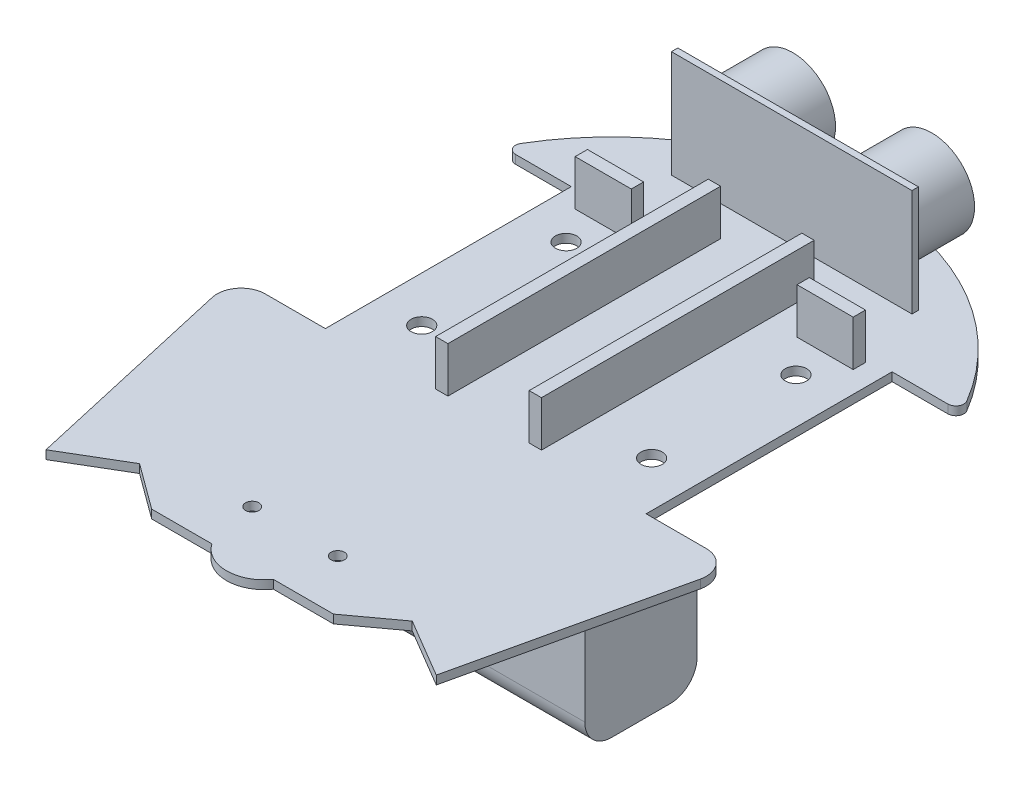
from build123d import *

# Parameters (mm, degrees)
BOSS_EXTRUDE1_DEPTH = 1.6
SKETCH6_W           = 45
SKETCH6_H           = 1.2
BOSS_EXTRUDE2_DEPTH = 20
SKETCH7_R           = 8
BOSS_EXTRUDE3_DEPTH = 12
SKETCH10_W          = 80
SKETCH10_H          = 21
BOSS_EXTRUDE4_DEPTH = 21.4
FILLET1_R           = 5
CUT_EXTRUDE1_REACH  = 132.929
SKETCH11_R          = 1.25
SKETCH11_R_2        = 2
SKETCH11_R_3        = 1.5
SKETCH12_W          = 2.3
SKETCH12_H          = 51
SKETCH12_W_2        = 10.5
SKETCH12_H_2        = 2.3
BOSS_EXTRUDE5_DEPTH = 8.5
SKETCH13_W          = 5.4
SKETCH13_H          = 10.2
BOSS_EXTRUDE7_DEPTH = 5


with BuildPart() as part:
    # Sketch5 → Boss-Extrude1 (new body)
    with BuildSketch(Plane(origin=(0, 0, 0), x_dir=(1, 0, 0), z_dir=(0, 1, 0))):
        with BuildLine():
            Line((-25.5, 9.227208522), (-17, 3))
            Line((-17, 3), (-5.744562647, 3))
            ThreePointArc((-5.744562647, 3), (0, 0), (5.744562647, 3))
            Line((5.744562647, 3), (17, 3))
            Line((17, 3), (25.5, 9.227208522))
            Line((25.5, 9.227208522), (36.5, 2.727208522))
            Line((36.5, 2.727208522), (45.638339075, 42.980975538))
            ThreePointArc((45.638339075, 42.980975538), (44.766606918, 46.784961322), (41.25, 48.477208522))
            Line((41.25, 48.477208522), (30, 48.477208522))
            Line((30, 48.477208522), (30, 94.477208522))
            Line((30, 94.477208522), (40.42392202, 94.477208522))
            ThreePointArc((40.42392202, 94.477208522), (41.72734925, 95.234862609), (41.714047191, 96.742438582))
            ThreePointArc((41.714047191, 96.742438582), (0, 120.5), (-41.714047191, 96.742438582))
            ThreePointArc((-41.714047191, 96.742438582), (-41.72734925, 95.234862609), (-40.42392202, 94.477208522))
            Line((-40.42392202, 94.477208522), (-30, 94.477208522))
            Line((-30, 94.477208522), (-30, 48.477208522))
            Line((-30, 48.477208522), (-41.25, 48.477208522))
            ThreePointArc((-41.25, 48.477208522), (-44.766606918, 46.784961322), (-45.638339075, 42.980975538))
            Line((-45.638339075, 42.980975538), (-36.5, 2.727208522))
            Line((-36.5, 2.727208522), (-25.5, 9.227208522))
        make_face()
    extrude(amount=-BOSS_EXTRUDE1_DEPTH)

    # Sketch6 → Boss-Extrude2 (add)
    with BuildSketch(Plane(origin=(0, 0, 0), x_dir=(1, 0, 0), z_dir=(0, 1, 0))):
        with Locations((0, 106.3)):
            Rectangle(SKETCH6_W, SKETCH6_H)
    extrude(amount=BOSS_EXTRUDE2_DEPTH)

    # Sketch7 → Boss-Extrude3 (add)
    with BuildSketch(Plane(origin=(0, 0, -106.9), x_dir=(-1, 0, 0), z_dir=(0, 0, -1))):
        with Locations(Location((-13, 10, 0), (0, 0, 180))):
            Circle(SKETCH7_R)
        with Locations(Location((13, 10, 0), (0, 0, 180))):
            Circle(SKETCH7_R)
    extrude(amount=BOSS_EXTRUDE3_DEPTH)

    # Sketch10 → Boss-Extrude4 (add)
    with BuildSketch(Plane.XZ.offset(1.6)):
        with Locations((0, -37.5)):
            Rectangle(SKETCH10_W, SKETCH10_H)
    extrude(amount=BOSS_EXTRUDE4_DEPTH)

    # Fillet1
    fillet1_edges = [part.edges().sort_by_distance(p)[0] for p in [
        (0, -23, -48),
        (0, -23, -27),
    ]]
    fillet(fillet1_edges, radius=FILLET1_R)

    # Sketch11 → Cut-Extrude1 (cut, up to next)
    with BuildSketch(Plane(origin=(0, 0, 0), x_dir=(1, 0, 0), z_dir=(0, 1, 0)), mode=Mode.PRIVATE) as cut_extrude1_sk1:
        with Locations(Location((-8, 12.8, 0), (0, 0, 270))):
            Circle(SKETCH11_R)
    cut_extrude1_tool1 = extrude(cut_extrude1_sk1.sketch, amount=-CUT_EXTRUDE1_REACH, mode=Mode.PRIVATE) & part.part
    # Sketch11 → Cut-Extrude1 (cut, up to next)
    with BuildSketch(Plane(origin=(0, 0, 0), x_dir=(1, 0, 0), z_dir=(0, 1, 0)), mode=Mode.PRIVATE) as cut_extrude1_sk2:
        with Locations(Location((-21.5, 58, 0), (0, 0, 270))):
            Circle(SKETCH11_R_2)
    cut_extrude1_tool2 = extrude(cut_extrude1_sk2.sketch, amount=-CUT_EXTRUDE1_REACH, mode=Mode.PRIVATE) & part.part
    # Sketch11 → Cut-Extrude1 (cut, up to next)
    with BuildSketch(Plane(origin=(0, 0, 0), x_dir=(1, 0, 0), z_dir=(0, 1, 0)), mode=Mode.PRIVATE) as cut_extrude1_sk3:
        with Locations(Location((-21.5, 85, 0), (0, 0, 270))):
            Circle(SKETCH11_R_2)
    cut_extrude1_tool3 = extrude(cut_extrude1_sk3.sketch, amount=-CUT_EXTRUDE1_REACH, mode=Mode.PRIVATE) & part.part
    # Sketch11 → Cut-Extrude1 (cut, up to next)
    with BuildSketch(Plane(origin=(0, 0, 0), x_dir=(1, 0, 0), z_dir=(0, 1, 0)), mode=Mode.PRIVATE) as cut_extrude1_sk4:
        with Locations(Location((-15, 99, 0), (0, 0, 270))):
            Circle(SKETCH11_R_3)
    cut_extrude1_tool4 = extrude(cut_extrude1_sk4.sketch, amount=-CUT_EXTRUDE1_REACH, mode=Mode.PRIVATE) & part.part
    # Sketch11 → Cut-Extrude1 (cut, up to next)
    with BuildSketch(Plane(origin=(0, 0, 0), x_dir=(1, 0, 0), z_dir=(0, 1, 0)), mode=Mode.PRIVATE) as cut_extrude1_sk5:
        with Locations(Location((15, 99, 0), (0, 0, 90))):
            Circle(SKETCH11_R_3)
    cut_extrude1_tool5 = extrude(cut_extrude1_sk5.sketch, amount=-CUT_EXTRUDE1_REACH, mode=Mode.PRIVATE) & part.part
    # Sketch11 → Cut-Extrude1 (cut, up to next)
    with BuildSketch(Plane(origin=(0, 0, 0), x_dir=(1, 0, 0), z_dir=(0, 1, 0)), mode=Mode.PRIVATE) as cut_extrude1_sk6:
        with Locations(Location((21.5, 85, 0), (0, 0, 90))):
            Circle(SKETCH11_R_2)
    cut_extrude1_tool6 = extrude(cut_extrude1_sk6.sketch, amount=-CUT_EXTRUDE1_REACH, mode=Mode.PRIVATE) & part.part
    # Sketch11 → Cut-Extrude1 (cut, up to next)
    with BuildSketch(Plane(origin=(0, 0, 0), x_dir=(1, 0, 0), z_dir=(0, 1, 0)), mode=Mode.PRIVATE) as cut_extrude1_sk7:
        with Locations(Location((21.5, 58, 0), (0, 0, 90))):
            Circle(SKETCH11_R_2)
    cut_extrude1_tool7 = extrude(cut_extrude1_sk7.sketch, amount=-CUT_EXTRUDE1_REACH, mode=Mode.PRIVATE) & part.part
    # Sketch11 → Cut-Extrude1 (cut, up to next)
    with BuildSketch(Plane(origin=(0, 0, 0), x_dir=(1, 0, 0), z_dir=(0, 1, 0)), mode=Mode.PRIVATE) as cut_extrude1_sk8:
        with Locations(Location((8, 12.8, 0), (0, 0, 90))):
            Circle(SKETCH11_R)
    cut_extrude1_tool8 = extrude(cut_extrude1_sk8.sketch, amount=-CUT_EXTRUDE1_REACH, mode=Mode.PRIVATE) & part.part
    add(cut_extrude1_tool1.solids().sort_by_distance((-8, 0, -12.8))[0], mode=Mode.SUBTRACT)
    add(cut_extrude1_tool2.solids().sort_by_distance((-21.5, 0, -58))[0], mode=Mode.SUBTRACT)
    add(cut_extrude1_tool3.solids().sort_by_distance((-21.5, 0, -85))[0], mode=Mode.SUBTRACT)
    add(cut_extrude1_tool4.solids().sort_by_distance((-15, 0, -99))[0], mode=Mode.SUBTRACT)
    add(cut_extrude1_tool5.solids().sort_by_distance((15, 0, -99))[0], mode=Mode.SUBTRACT)
    add(cut_extrude1_tool6.solids().sort_by_distance((21.5, 0, -85))[0], mode=Mode.SUBTRACT)
    add(cut_extrude1_tool7.solids().sort_by_distance((21.5, 0, -58))[0], mode=Mode.SUBTRACT)
    add(cut_extrude1_tool8.solids().sort_by_distance((8, 0, -12.8))[0], mode=Mode.SUBTRACT)

    # Sketch12 → Boss-Extrude5 (add)
    with BuildSketch(Plane(origin=(0, 0, 0), x_dir=(1, 0, 0), z_dir=(0, 1, 0))):
        with Locations((-8.75, 74.5)):
            Rectangle(SKETCH12_W, SKETCH12_H)
        with Locations((-20.75, 92.35)):
            Rectangle(SKETCH12_W_2, SKETCH12_H_2)
        with Locations((20.75, 92.35)):
            Rectangle(SKETCH12_W_2, SKETCH12_H_2)
        with Locations((8.75, 74.5)):
            Rectangle(SKETCH12_W, SKETCH12_H)
    extrude(amount=BOSS_EXTRUDE5_DEPTH)

    # Sketch13 → Boss-Extrude7 (add)
    with BuildSketch(Plane.XZ.offset(1.6)):
        with Locations((4.2, -111.6)):
            Rectangle(SKETCH13_W, SKETCH13_H)
        with Locations((-4.2, -111.6)):
            Rectangle(SKETCH13_W, SKETCH13_H)
        with Locations((-19.1, -107)):
            Rectangle(SKETCH13_W, SKETCH13_H)
        with Locations((19.1, -107)):
            Rectangle(SKETCH13_W, SKETCH13_H)
    extrude(amount=BOSS_EXTRUDE7_DEPTH)


solid = part.part
